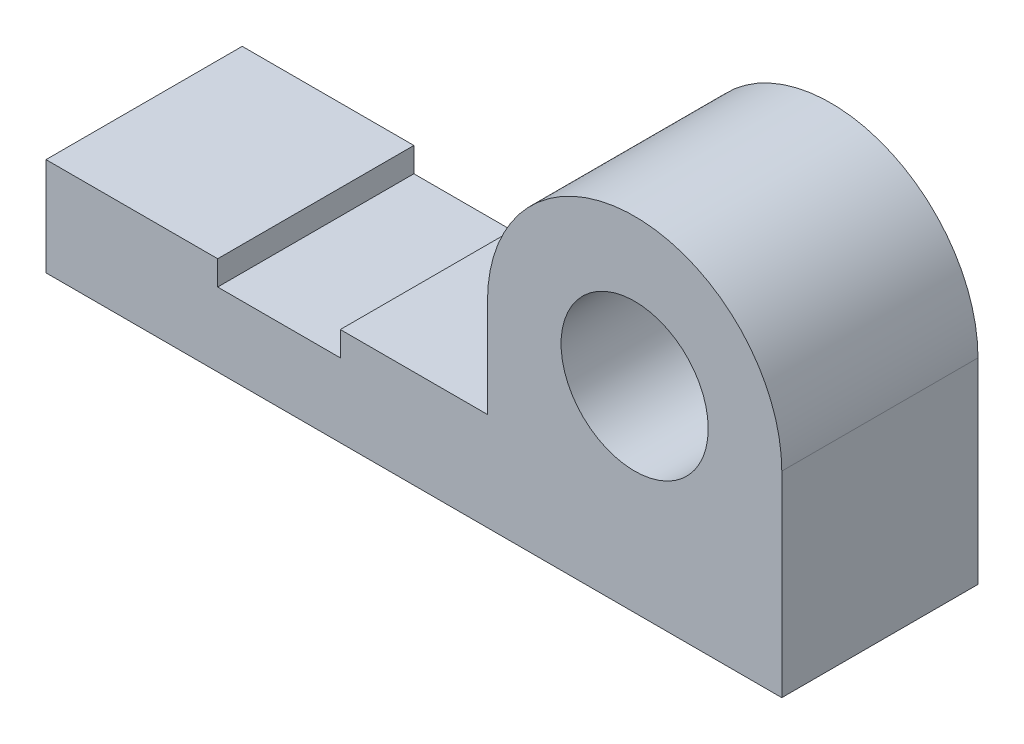
from build123d import *

# Parameters (mm, degrees)
SKETCH2_R           = 15
BOSS_EXTRUDE1_DEPTH = 20


with BuildPart() as part:
    # Sketch2 → Boss-Extrude1 (new, symmetric)
    with BuildSketch(Plane.XY):
        with BuildLine():
            Line((0, 0), (-150, 0))
            Line((-150, 0), (-150, 20))
            Line((-150, 20), (-115, 20))
            Line((-115, 20), (-115, 15))
            Line((-115, 15), (-90, 15))
            Line((-90, 15), (-90, 20))
            Line((-90, 20), (-60, 20))
            Line((-60, 20), (-60, 40))
            ThreePointArc((-60, 40), (-30, 70), (0, 40))
            Line((0, 40), (0, 0))
        make_face()
        with Locations((-30, 40)):
            Circle(SKETCH2_R, mode=Mode.SUBTRACT)
    extrude(amount=BOSS_EXTRUDE1_DEPTH, both=True)


solid = part.part
